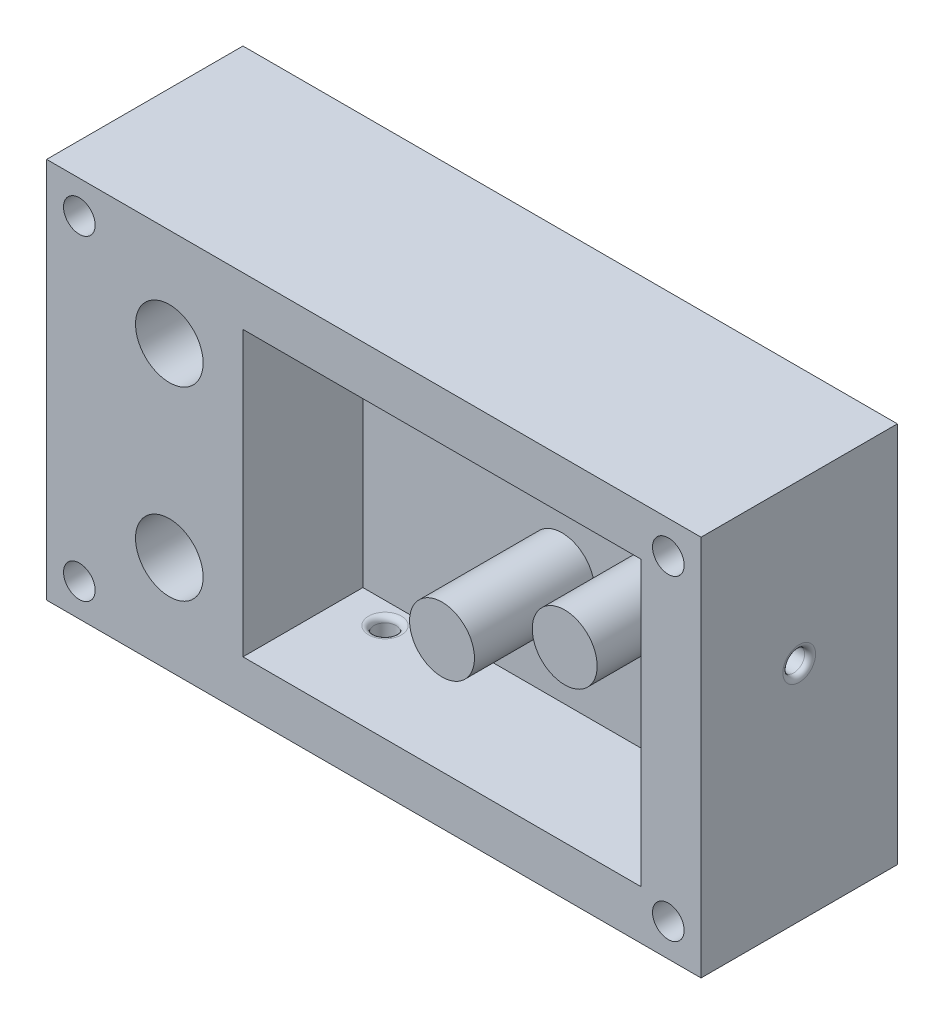
from build123d import *

# Parameters (mm, degrees)
SKETCH1_W           = 60
SKETCH1_H           = 35
BOSS_EXTRUDE1_DEPTH = 18
SKETCH2_R           = 3.1
CUT_EXTRUDE1_DEPTH  = 18
SKETCH3_R           = 1.45
SKETCH3_W           = 36.5
SKETCH3_H           = 26
CUT_EXTRUDE2_DEPTH  = 11
SKETCH4_R           = 2.975
BOSS_EXTRUDE2_DEPTH = 11
SKETCH6_R           = 1
CUT_EXTRUDE3_DEPTH  = 5.8
SKETCH8_R           = 1
CUT_EXTRUDE4_DEPTH  = 5.8
FILLET2_R           = 0.5


with BuildPart() as part:
    # Sketch1 → Boss-Extrude1 (new body)
    with BuildSketch(Plane.XY):
        with Locations((30, 17.5)):
            Rectangle(SKETCH1_W, SKETCH1_H)
    extrude(amount=BOSS_EXTRUDE1_DEPTH)

    # Sketch2 → Cut-Extrude1 (cut)
    with BuildSketch(Plane.XY.offset(18)):
        with Locations((11.25, 26)):
            Circle(SKETCH2_R)
        with Locations((11.25, 9)):
            Circle(SKETCH2_R)
    extrude(amount=-CUT_EXTRUDE1_DEPTH, mode=Mode.SUBTRACT)

    # Sketch3 → Cut-Extrude2 (cut)
    with BuildSketch(Plane.XY.offset(18)):
        with Locations((3, 32)):
            Circle(SKETCH3_R)
        with Locations((57, 32)):
            Circle(SKETCH3_R)
        with Locations((57, 3)):
            Circle(SKETCH3_R)
        with Locations((3, 3)):
            Circle(SKETCH3_R)
        with Locations((36.25, 17.5)):
            Rectangle(SKETCH3_W, SKETCH3_H)
    extrude(amount=-CUT_EXTRUDE2_DEPTH, mode=Mode.SUBTRACT)

    # Sketch4 → Boss-Extrude2 (add)
    with BuildSketch(Plane.XY.offset(7)):
        with Locations(Location((36.25, 15, 0), (0, 0, 180))):
            Circle(SKETCH4_R)
        with Locations(Location((47.5, 20, 0), (0, 0, 180))):
            Circle(SKETCH4_R)
    extrude(amount=BOSS_EXTRUDE2_DEPTH)

    # Sketch6 → Cut-Extrude3 (cut)
    with BuildSketch(Plane(origin=(60, 0, 0), x_dir=(0, 0, -1), z_dir=(1, 0, 0))):
        with Locations((-9, 20.475)):
            Circle(SKETCH6_R)
    extrude(amount=-CUT_EXTRUDE3_DEPTH, mode=Mode.SUBTRACT)

    # Sketch8 → Cut-Extrude4 (cut)
    with BuildSketch(Plane.XZ):
        with Locations(Location((22.025, 9, 0), (0, 0, 270))):
            Circle(SKETCH8_R)
    extrude(amount=-CUT_EXTRUDE4_DEPTH, mode=Mode.SUBTRACT)

    # Fillet2
    fillet2_edges = [part.edges().sort_by_distance(p)[0] for p in [
        (54.5, 20.475, 10),
        (60, 20.475, 10),
        (22.025, 4.5, 10),
        (22.025, 0, 10),
    ]]
    fillet(fillet2_edges, radius=FILLET2_R)


solid = part.part
